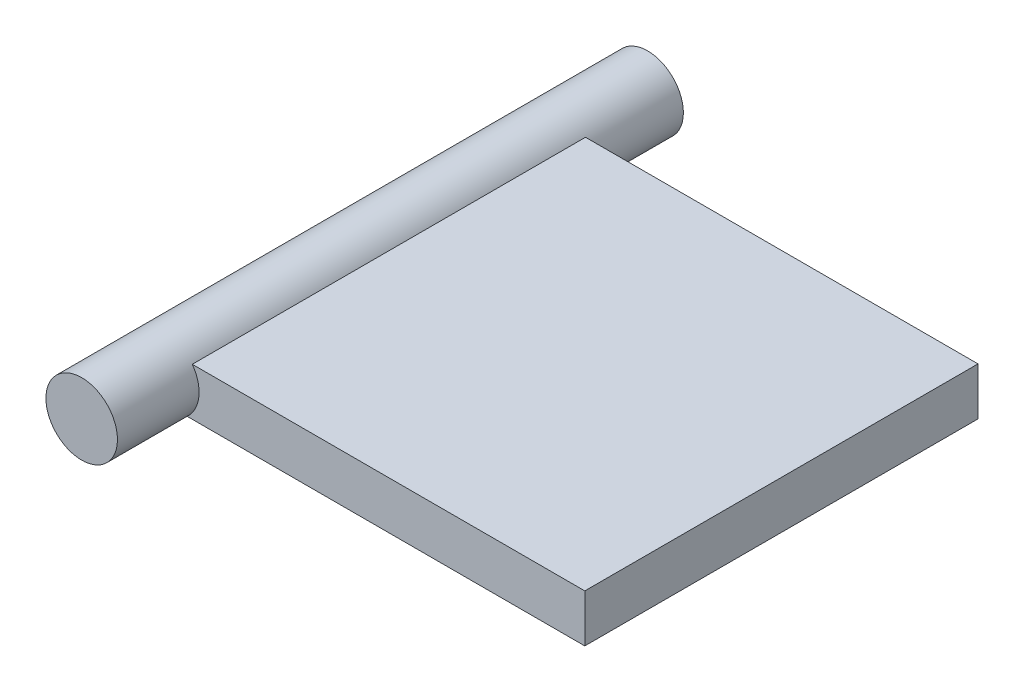
from build123d import *

# Parameters (mm, degrees)
SKETCH1_R           = 75
BOSS_EXTRUDE1_DEPTH = 1187
SKETCH3_W           = 824.711862224
SKETCH3_H           = 100
BOSS_EXTRUDE2_DEPTH = 874


with BuildPart() as part:
    # Sketch1 → Boss-Extrude1 (new body)
    with BuildSketch(Plane.XY):
        with Locations(Location((0, 0, 0), (0, 0, 180))):
            Circle(SKETCH1_R)
    extrude(amount=BOSS_EXTRUDE1_DEPTH)

    # Sketch3 → Boss-Extrude2 (add)
    with BuildSketch(Plane(origin=(10, 0, 0), x_dir=(0, 0, -1), z_dir=(1, 0, 0))):
        with Locations((-603.421893573, -6.041666237)):
            Rectangle(SKETCH3_W, SKETCH3_H)
    extrude(amount=BOSS_EXTRUDE2_DEPTH)


solid = part.part
